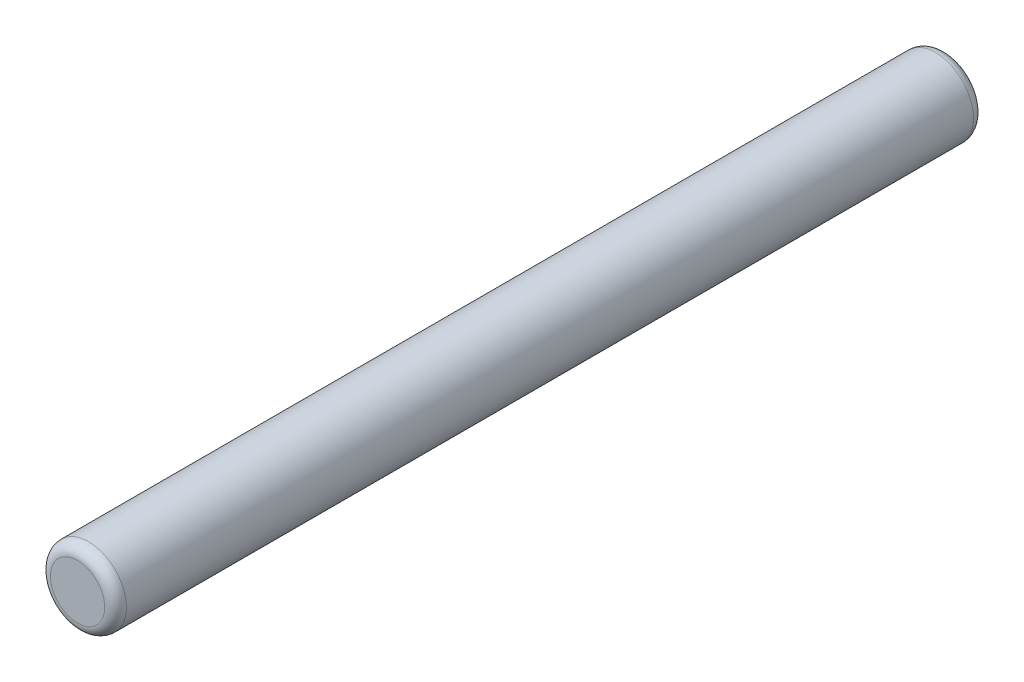
from build123d import *

# Parameters (mm, degrees)
SKETCH_1_R      = 0.875
EXTRUDE_1_DEPTH = 20
FILLET_2_R      = 0.25


with BuildPart() as part:
    # Эскиз1 → Бобышка-Вытянуть1 (new body)
    with BuildSketch(Plane.XY):
        Circle(SKETCH_1_R)
    extrude(amount=EXTRUDE_1_DEPTH)

    # Скругление2
    fillet_2_edges = [part.edges().sort_by_distance(p)[0] for p in [
        (-0.875, 0, 0),
        (-0.875, 0, 20),
    ]]
    fillet(fillet_2_edges, radius=FILLET_2_R)


solid = part.part
